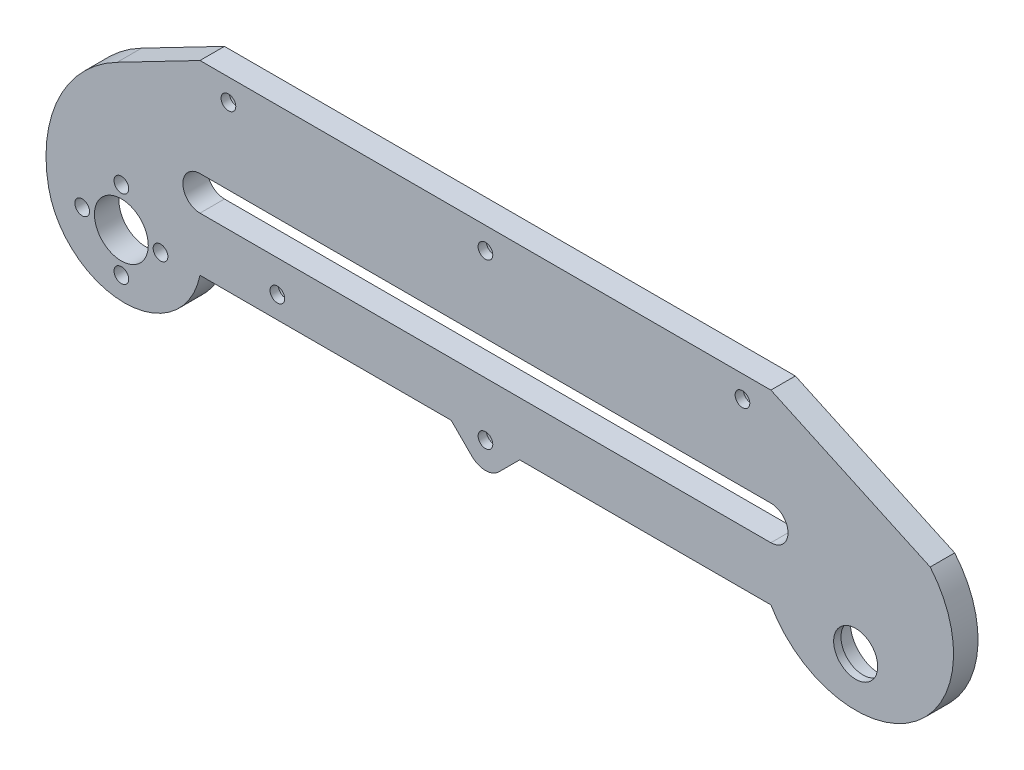
from build123d import *

# Parameters (mm, degrees)
SKETCH1_R           = 5.5
SKETCH1_R_2         = 1.5
SKETCH1_R_3         = 4.5
BOSS_EXTRUDE1_DEPTH = 5
SKETCH4_R           = 6.1
CUT_EXTRUDE1_DEPTH  = 3.5
SKETCH5_R           = 1.5
CUT_EXTRUDE2_DEPTH  = 5
SKETCH6_R           = 1.5
CUT_EXTRUDE3_DEPTH  = 10
SKETCH7_R           = 2.9
CUT_EXTRUDE4_DEPTH  = 3.3


with BuildPart() as part:
    # Sketch1 → Boss-Extrude1 (new body)
    with BuildSketch(Plane.XY):
        with BuildLine():
            Line((-58.308676511, 22.996128985), (58.308676511, 22.996128985))
            Line((58.308676511, 22.996128985), (75.629184587, 15))
            Line((75.629184587, 15), (90.85122644, 7.972642053))
            ThreePointArc((90.85122644, 7.972642053), (87.163327852, -21.339018917), (58.308676511, -15))
            Line((58.308676511, -15), (7, -15))
            Line((7, -15), (2.757359313, -19.242640687))
            ThreePointArc((2.757359313, -19.242640687), (0, -20.384776311), (-2.757359313, -19.242640687))
            Line((-2.757359313, -19.242640687), (-7, -15))
            Line((-7, -15), (-58.308676511, -15))
            ThreePointArc((-58.308676511, -15), (-73.76298075, -27.603590324), (-89.217284989, -15))
            ThreePointArc((-89.217284989, -15), (-87.141316573, 1.955509585), (-75.243665272, 14.212949924))
            Line((-75.243665272, 14.212949924), (-58.308676511, 22.996128985))
        make_face()
        with Locations((-74.370815413, -15)):
            Circle(SKETCH1_R, mode=Mode.SUBTRACT)
        with Locations(Location((-74.370815413, -7, 0), (0, 0, 180))):
            Circle(SKETCH1_R_2, mode=Mode.SUBTRACT)
        with Locations((75.629184587, -15)):
            Circle(SKETCH1_R_3, mode=Mode.SUBTRACT)
        with Locations((0, -15.003871015)):
            Circle(SKETCH1_R_2, mode=Mode.SUBTRACT)
        with Locations(Location((-66.370815413, -15, 0), (0, 0, 180))):
            Circle(SKETCH1_R_2, mode=Mode.SUBTRACT)
        with Locations(Location((-74.370815413, -23, 0), (0, 0, 180))):
            Circle(SKETCH1_R_2, mode=Mode.SUBTRACT)
        with Locations(Location((-82.370815413, -15, 0), (0, 0, 180))):
            Circle(SKETCH1_R_2, mode=Mode.SUBTRACT)
        with BuildLine():
            Line((-58.308676511, -4.003871015), (58.308676511, -4.003871015))
            ThreePointArc((58.308676511, -4.003871015), (61.808676511, -0.503871015), (58.308676511, 2.996128985))
            Line((58.308676511, 2.996128985), (-58.308676511, 2.996128985))
            ThreePointArc((-58.308676511, 2.996128985), (-61.808676511, -0.503871015), (-58.308676511, -4.003871015))
        make_face(mode=Mode.SUBTRACT)
    extrude(amount=BOSS_EXTRUDE1_DEPTH)

    # Sketch4 → Cut-Extrude1 (cut)
    with BuildSketch(Plane(origin=(0, 0, 0), x_dir=(-1, 0, 0), z_dir=(0, 0, -1))):
        with Locations((-75.629184587, -15)):
            Circle(SKETCH4_R)
    extrude(amount=-CUT_EXTRUDE1_DEPTH, mode=Mode.SUBTRACT)

    # Sketch5 → Cut-Extrude2 (cut)
    with BuildSketch(Plane(origin=(0, 0, 0), x_dir=(-1, 0, 0), z_dir=(0, 0, -1))):
        with Locations((0, 18.496128985)):
            Circle(SKETCH5_R)
        with Locations((52.5, 18.496128985)):
            Circle(SKETCH5_R)
        with Locations((-52.5, 18.496128985)):
            Circle(SKETCH5_R)
    extrude(amount=-CUT_EXTRUDE2_DEPTH, mode=Mode.SUBTRACT)

    # Sketch6 → Cut-Extrude3 (cut)
    with BuildSketch(Plane(origin=(0, 0, 0), x_dir=(-1, 0, 0), z_dir=(0, 0, -1))):
        with Locations((42.5, -10.5)):
            Circle(SKETCH6_R)
    extrude(amount=-CUT_EXTRUDE3_DEPTH, mode=Mode.SUBTRACT)

    # Sketch7 → Cut-Extrude4 (cut)
    with BuildSketch(Plane(origin=(0, 0, 0), x_dir=(-1, 0, 0), z_dir=(0, 0, -1))):
        with Locations((42.5, -10.5)):
            Circle(SKETCH7_R)
        with Locations((0, -15.003871015)):
            Circle(SKETCH7_R)
        with Locations((0, 18.496128985)):
            Circle(SKETCH7_R)
        with Locations((52.5, 18.496128985)):
            Circle(SKETCH7_R)
        with Locations((-52.5, 18.496128985)):
            Circle(SKETCH7_R)
    extrude(amount=-CUT_EXTRUDE4_DEPTH, mode=Mode.SUBTRACT)


solid = part.part
